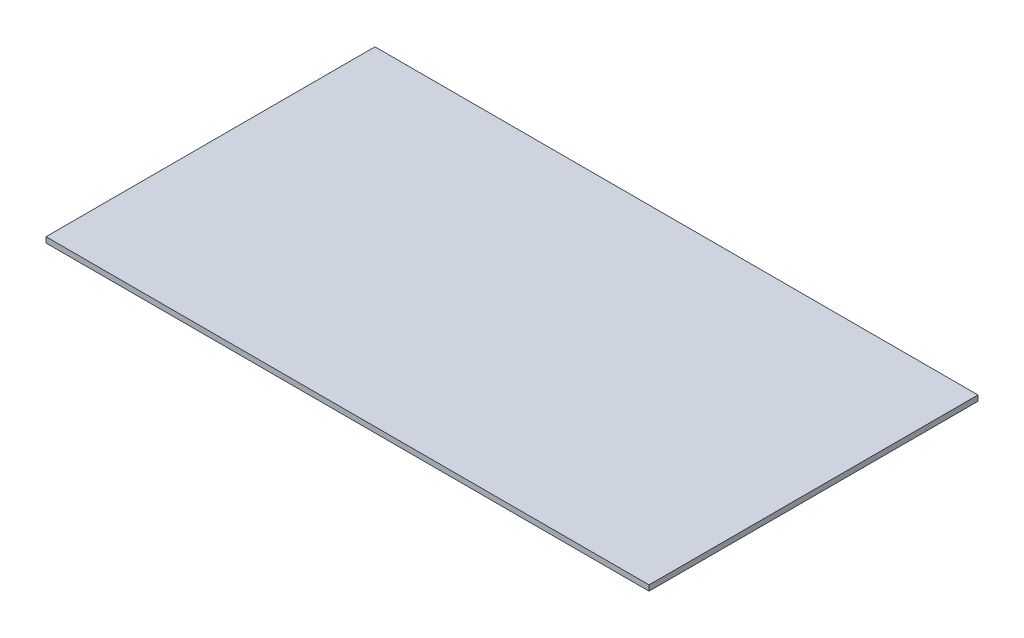
from build123d import *

# Parameters (mm, degrees)
SKETCH_1_W      = 550
SKETCH_1_H      = 300
EXTRUDE_1_DEPTH = 5


with BuildPart() as part:
    # ｽｹｯﾁ1 → ﾎﾞｽ - 押し出し1 (new body)
    with BuildSketch(Plane(origin=(0, 0, 0), x_dir=(1, 0, 0), z_dir=(0, 1, 0))):
        Rectangle(SKETCH_1_W, SKETCH_1_H)
    extrude(amount=EXTRUDE_1_DEPTH)


solid = part.part
